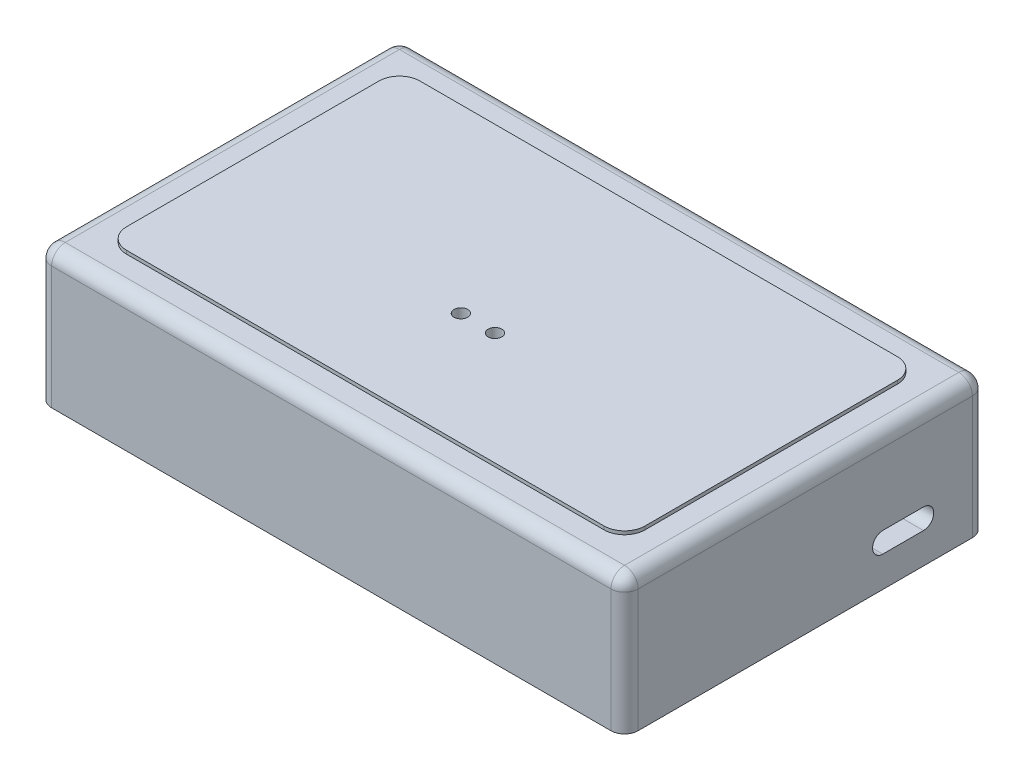
from build123d import *

# Parameters (mm, degrees)
BOSS_EXTRUDE1_DEPTH = 20
FILLET1_R           = 2
BOSS_EXTRUDE2_DEPTH = 0.5
CUT_EXTRUDE1_DEPTH  = 17
CUT_EXTRUDE2_DEPTH  = 3
SKETCH5_R           = 1
CUT_EXTRUDE3_DEPTH  = 10
SKETCH6_R           = 1.5
CUT_EXTRUDE4_DEPTH  = 10


with BuildPart() as part:
    # Sketch1 → Boss-Extrude1 (new body)
    with BuildSketch(Plane(origin=(0, 0, 0), x_dir=(1, 0, 0), z_dir=(0, 1, 0))):
        with BuildLine():
            Line((-41, 26.5), (41, 26.5))
            ThreePointArc((41, 26.5), (42.414213562, 25.914213562), (43, 24.5))
            Line((43, 24.5), (43, -24.5))
            ThreePointArc((43, -24.5), (42.414213562, -25.914213562), (41, -26.5))
            Line((41, -26.5), (-41, -26.5))
            ThreePointArc((-41, -26.5), (-42.414213562, -25.914213562), (-43, -24.5))
            Line((-43, -24.5), (-43, 24.5))
            ThreePointArc((-43, 24.5), (-42.414213562, 25.914213562), (-41, 26.5))
        make_face()
    extrude(amount=BOSS_EXTRUDE1_DEPTH)

    # Fillet1
    fillet1_edges = [part.edges().sort_by_distance(p)[0] for p in [
        (-42.414213562, 20, -25.914213562),
        (-43, 20, 0),
        (-42.414213562, 20, 25.914213562),
        (0, 20, 26.5),
        (42.414213562, 20, 25.914213562),
        (43, 20, 0),
        (42.414213562, 20, -25.914213562),
        (0, 20, -26.5),
    ]]
    fillet(fillet1_edges, radius=FILLET1_R)

    # Sketch2 → Boss-Extrude2 (add)
    with BuildSketch(Plane(origin=(0, 20, 0), x_dir=(1, 0, 0), z_dir=(0, 1, 0))):
        with BuildLine():
            Line((-35, 21.5), (35, 21.5))
            ThreePointArc((35, 21.5), (37.121320344, 20.621320344), (38, 18.5))
            Line((38, 18.5), (38, -18.5))
            ThreePointArc((38, -18.5), (37.121320344, -20.621320344), (35, -21.5))
            Line((35, -21.5), (-35, -21.5))
            ThreePointArc((-35, -21.5), (-37.121320344, -20.621320344), (-38, -18.5))
            Line((-38, -18.5), (-38, 18.5))
            ThreePointArc((-38, 18.5), (-37.121320344, 20.621320344), (-35, 21.5))
        make_face()
    extrude(amount=BOSS_EXTRUDE2_DEPTH)

    # Sketch3 → Cut-Extrude1 (cut)
    with BuildSketch(Plane.XZ):
        with BuildLine():
            Line((-37, 23.5), (37, 23.5))
            ThreePointArc((37, 23.5), (39.121320344, 22.621320344), (40, 20.5))
            Line((40, 20.5), (40, -20.5))
            ThreePointArc((40, -20.5), (39.121320344, -22.621320344), (37, -23.5))
            Line((37, -23.5), (-37, -23.5))
            ThreePointArc((-37, -23.5), (-39.121320344, -22.621320344), (-40, -20.5))
            Line((-40, -20.5), (-40, 20.5))
            ThreePointArc((-40, 20.5), (-39.121320344, 22.621320344), (-37, 23.5))
        make_face()
    extrude(amount=-CUT_EXTRUDE1_DEPTH, mode=Mode.SUBTRACT)

    # Sketch4 → Cut-Extrude2 (cut)
    with BuildSketch(Plane.XZ):
        with BuildLine():
            Line((38.25, -24.75), (-38.25, -24.75))
            ThreePointArc((-38.25, -24.75), (-40.371320344, -23.871320344), (-41.25, -21.75))
            Line((-41.25, -21.75), (-41.25, 21.75))
            ThreePointArc((-41.25, 21.75), (-40.371320344, 23.871320344), (-38.25, 24.75))
            Line((-38.25, 24.75), (38.25, 24.75))
            ThreePointArc((38.25, 24.75), (40.371320344, 23.871320344), (41.25, 21.75))
            Line((41.25, 21.75), (41.25, -21.75))
            ThreePointArc((41.25, -21.75), (40.371320344, -23.871320344), (38.25, -24.75))
        make_face()
    extrude(amount=-CUT_EXTRUDE2_DEPTH, mode=Mode.SUBTRACT)

    # Sketch5 → Cut-Extrude3 (cut)
    with BuildSketch(Plane(origin=(0, 20.5, 0), x_dir=(1, 0, 0), z_dir=(0, 1, 0))):
        with Locations(Location((-2.5, -5, 0), (0, 0, 270))):
            Circle(SKETCH5_R)
        with Locations(Location((2.5, -5, 0), (0, 0, 270))):
            Circle(SKETCH5_R)
    extrude(amount=-CUT_EXTRUDE3_DEPTH, mode=Mode.SUBTRACT)

    # Sketch6 → Cut-Extrude4 (cut)
    with BuildSketch(Plane(origin=(43, 0, 0), x_dir=(0, 0, -1), z_dir=(1, 0, 0))):
        with Locations((11.365424158, 6)):
            Circle(SKETCH6_R)
        with BuildLine():
            Line((17.332844904, 7.5), (11.365424158, 7.5))
            ThreePointArc((11.365424158, 7.5), (12.426084329, 7.060660172), (12.865424158, 6))
            ThreePointArc((12.865424158, 6), (12.426084329, 4.939339828), (11.365424158, 4.5))
            Line((11.365424158, 4.5), (17.332844904, 4.5))
            ThreePointArc((17.332844904, 4.5), (15.832844904, 6), (17.332844904, 7.5))
        make_face()
        with Locations((17.332844904, 6)):
            Circle(SKETCH6_R)
    extrude(amount=-CUT_EXTRUDE4_DEPTH, mode=Mode.SUBTRACT)


solid = part.part
